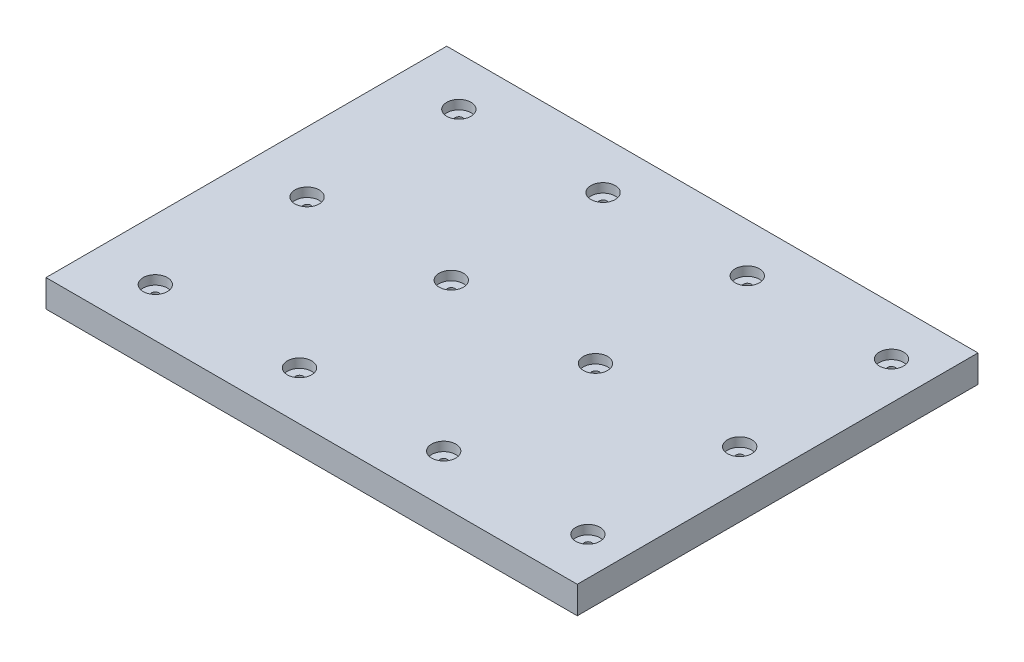
from build123d import *

# Parameters (mm, degrees)
SKETCH2_W           = 920
SKETCH2_H           = 264
BOSS_EXTRUDE1_DEPTH = 18
SKETCH1_R           = 2.5
CUT_EXTRUDE2_DEPTH  = 18
SKETCH3_R           = 8
CUT_EXTRUDE3_DEPTH  = 6
SKETCH4_W           = 570
SKETCH4_H           = 264
CUT_EXTRUDE4_DEPTH  = 20


with BuildPart() as part:
    # Sketch2 → Boss-Extrude1 (new body)
    with BuildSketch(Plane(origin=(0, 0, 0), x_dir=(1, 0, 0), z_dir=(0, 1, 0))):
        with Locations((460, 132)):
            Rectangle(SKETCH2_W, SKETCH2_H)
    extrude(amount=BOSS_EXTRUDE1_DEPTH)

    # Sketch1 → Cut-Extrude2 (cut)
    with BuildSketch(Plane(origin=(0, 18, 0), x_dir=(1, 0, 0), z_dir=(0, 1, 0))):
        with Locations(Location((40, 32, 0), (0, 0, 270))):
            Circle(SKETCH1_R)
        with Locations(Location((135, 32, 0), (0, 0, 270))):
            Circle(SKETCH1_R)
        with Locations(Location((230, 32, 0), (0, 0, 270))):
            Circle(SKETCH1_R)
        with Locations(Location((325, 32, 0), (0, 0, 270))):
            Circle(SKETCH1_R)
        with Locations(Location((420, 32, 0), (0, 0, 270))):
            Circle(SKETCH1_R)
        with Locations(Location((515, 32, 0), (0, 0, 270))):
            Circle(SKETCH1_R)
        with Locations(Location((610, 32, 0), (0, 0, 270))):
            Circle(SKETCH1_R)
        with Locations(Location((705, 32, 0), (0, 0, 270))):
            Circle(SKETCH1_R)
        with Locations(Location((800, 32, 0), (0, 0, 270))):
            Circle(SKETCH1_R)
        with Locations(Location((895, 32, 0), (0, 0, 270))):
            Circle(SKETCH1_R)
        with Locations(Location((135, 132, 0), (0, 0, 270))):
            Circle(SKETCH1_R)
        with Locations(Location((230, 132, 0), (0, 0, 270))):
            Circle(SKETCH1_R)
        with Locations(Location((325, 132, 0), (0, 0, 270))):
            Circle(SKETCH1_R)
        with Locations(Location((420, 132, 0), (0, 0, 270))):
            Circle(SKETCH1_R)
        with Locations(Location((515, 132, 0), (0, 0, 270))):
            Circle(SKETCH1_R)
        with Locations(Location((610, 132, 0), (0, 0, 270))):
            Circle(SKETCH1_R)
        with Locations(Location((705, 132, 0), (0, 0, 270))):
            Circle(SKETCH1_R)
        with Locations(Location((800, 132, 0), (0, 0, 270))):
            Circle(SKETCH1_R)
        with Locations(Location((895, 132, 0), (0, 0, 270))):
            Circle(SKETCH1_R)
        with Locations(Location((135, 232, 0), (0, 0, 270))):
            Circle(SKETCH1_R)
        with Locations(Location((230, 232, 0), (0, 0, 270))):
            Circle(SKETCH1_R)
        with Locations(Location((325, 232, 0), (0, 0, 270))):
            Circle(SKETCH1_R)
        with Locations(Location((420, 232, 0), (0, 0, 270))):
            Circle(SKETCH1_R)
        with Locations(Location((515, 232, 0), (0, 0, 270))):
            Circle(SKETCH1_R)
        with Locations(Location((610, 232, 0), (0, 0, 270))):
            Circle(SKETCH1_R)
        with Locations(Location((705, 232, 0), (0, 0, 270))):
            Circle(SKETCH1_R)
        with Locations(Location((800, 232, 0), (0, 0, 270))):
            Circle(SKETCH1_R)
        with Locations(Location((895, 232, 0), (0, 0, 270))):
            Circle(SKETCH1_R)
        with Locations(Location((40, 132, 0), (0, 0, 270))):
            Circle(SKETCH1_R)
        with Locations(Location((40, 232, 0), (0, 0, 270))):
            Circle(SKETCH1_R)
    extrude(amount=-CUT_EXTRUDE2_DEPTH, mode=Mode.SUBTRACT)

    # Sketch3 → Cut-Extrude3 (cut)
    with BuildSketch(Plane(origin=(0, 18, 0), x_dir=(1, 0, 0), z_dir=(0, 1, 0))):
        with Locations(Location((40, 32, 0), (0, 0, 270))):
            Circle(SKETCH3_R)
        with Locations(Location((135, 32, 0), (0, 0, 270))):
            Circle(SKETCH3_R)
        with Locations(Location((230, 32, 0), (0, 0, 270))):
            Circle(SKETCH3_R)
        with Locations(Location((325, 32, 0), (0, 0, 270))):
            Circle(SKETCH3_R)
        with Locations(Location((420, 32, 0), (0, 0, 270))):
            Circle(SKETCH3_R)
        with Locations(Location((515, 32, 0), (0, 0, 270))):
            Circle(SKETCH3_R)
        with Locations(Location((610, 32, 0), (0, 0, 270))):
            Circle(SKETCH3_R)
        with Locations(Location((705, 32, 0), (0, 0, 270))):
            Circle(SKETCH3_R)
        with Locations(Location((800, 32, 0), (0, 0, 270))):
            Circle(SKETCH3_R)
        with Locations(Location((895, 32, 0), (0, 0, 270))):
            Circle(SKETCH3_R)
        with Locations(Location((135, 132, 0), (0, 0, 270))):
            Circle(SKETCH3_R)
        with Locations(Location((230, 132, 0), (0, 0, 270))):
            Circle(SKETCH3_R)
        with Locations(Location((325, 132, 0), (0, 0, 270))):
            Circle(SKETCH3_R)
        with Locations(Location((420, 132, 0), (0, 0, 270))):
            Circle(SKETCH3_R)
        with Locations(Location((515, 132, 0), (0, 0, 270))):
            Circle(SKETCH3_R)
        with Locations(Location((610, 132, 0), (0, 0, 270))):
            Circle(SKETCH3_R)
        with Locations(Location((705, 132, 0), (0, 0, 270))):
            Circle(SKETCH3_R)
        with Locations(Location((800, 132, 0), (0, 0, 270))):
            Circle(SKETCH3_R)
        with Locations(Location((895, 132, 0), (0, 0, 270))):
            Circle(SKETCH3_R)
        with Locations(Location((135, 232, 0), (0, 0, 270))):
            Circle(SKETCH3_R)
        with Locations(Location((230, 232, 0), (0, 0, 270))):
            Circle(SKETCH3_R)
        with Locations(Location((325, 232, 0), (0, 0, 270))):
            Circle(SKETCH3_R)
        with Locations(Location((420, 232, 0), (0, 0, 270))):
            Circle(SKETCH3_R)
        with Locations(Location((515, 232, 0), (0, 0, 270))):
            Circle(SKETCH3_R)
        with Locations(Location((610, 232, 0), (0, 0, 270))):
            Circle(SKETCH3_R)
        with Locations(Location((705, 232, 0), (0, 0, 270))):
            Circle(SKETCH3_R)
        with Locations(Location((800, 232, 0), (0, 0, 270))):
            Circle(SKETCH3_R)
        with Locations(Location((895, 232, 0), (0, 0, 270))):
            Circle(SKETCH3_R)
        with Locations(Location((40, 132, 0), (0, 0, 270))):
            Circle(SKETCH3_R)
        with Locations(Location((40, 232, 0), (0, 0, 270))):
            Circle(SKETCH3_R)
    extrude(amount=-CUT_EXTRUDE3_DEPTH, mode=Mode.SUBTRACT)

    # Sketch4 → Cut-Extrude4 (cut)
    with BuildSketch(Plane(origin=(0, 18, 0), x_dir=(1, 0, 0), z_dir=(0, 1, 0))):
        with Locations((635, 132)):
            Rectangle(SKETCH4_W, SKETCH4_H)
    extrude(amount=-CUT_EXTRUDE4_DEPTH, mode=Mode.SUBTRACT)


solid = part.part
